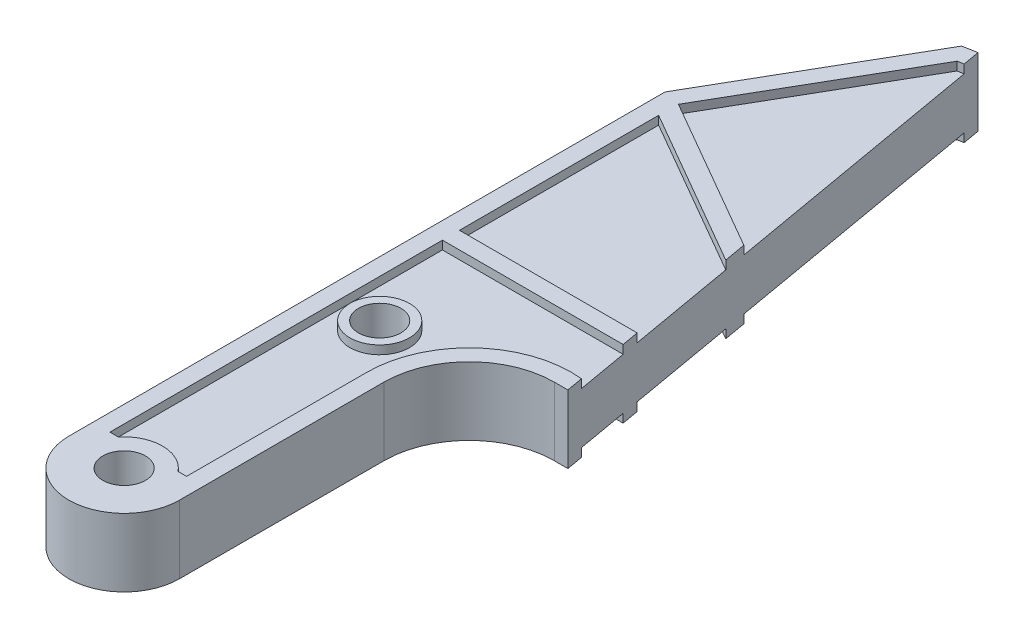
from build123d import *

# Parameters (mm, degrees)
CROQUIS2_R               = 2.5
SALIENTE_EXTRUIR1_DEPTH  = 8
CROQUIS3_R               = 3.5
CORTAR_EXTRUIR1_DEPTH    = 1
CORTAR_EXTRUIR2_START    = -1
CROQUIS4_R               = 3.5
CORTAR_EXTRUIR2_DEPTH    = 1
BOSS_EXTRUDE1_DEPTH      = 10
BOSS_EXTRUDE1_DEPTH_BACK = 18
CUT_EXTRUDE1_DEPTH       = 10
CUT_EXTRUDE2_DEPTH       = 46
CUT_EXTRUDE2_DEPTH_BACK  = 31


with BuildPart() as part:
    # Croquis2 → Saliente-Extruir1 (new body)
    with BuildSketch(Plane(origin=(0, 0, 0), x_dir=(1, 0, 0), z_dir=(0, 1, 0))):
        with BuildLine():
            Line((-6.5, 70), (-6.5, 0))
            ThreePointArc((-6.5, 0), (0, -6.5), (6.5, 0))
            Line((6.5, 0), (6.5, 24))
            ThreePointArc((6.5, 24), (9.428932188, 31.071067812), (16.5, 34))
            Line((16.5, 34), (19.5, 34))
            Line((19.5, 34), (21.621320344, 36.121320344))
            Line((21.621320344, 36.121320344), (19.621320344, 38.121320344))
            Line((19.621320344, 38.121320344), (21.621320344, 40.121320344))
            Line((21.621320344, 40.121320344), (19.621320344, 42.121320344))
            Line((19.621320344, 42.121320344), (21.621320344, 44.121320344))
            ThreePointArc((21.621320344, 44.121320344), (15.831267135, 61.441250358), (13.535653981, 79.558503244))
            Line((13.535653981, 79.558503244), (11.21874212, 81.180822395))
            Line((11.21874212, 81.180822395), (12.841061271, 83.497734256))
            Line((12.841061271, 83.497734256), (10.524149409, 85.120053407))
            Line((10.524149409, 85.120053407), (12.14646856, 87.436965268))
            Line((12.14646856, 87.436965268), (9.829556699, 89.059284419))
            Line((9.829556699, 89.059284419), (11.451875849, 91.37619628))
            Line((11.451875849, 91.37619628), (11.174038765, 92.951888685))
            Line((11.174038765, 92.951888685), (6.25, 92.083647797))
            Line((6.25, 92.083647797), (-6.5, 70))
        make_face()
        with Locations(Location((0, 0, 0), (0, 0, 270))):
            Circle(CROQUIS2_R, mode=Mode.SUBTRACT)
        with Locations(Location((0, 30, 0), (0, 0, 270))):
            Circle(CROQUIS2_R, mode=Mode.SUBTRACT)
    extrude(amount=SALIENTE_EXTRUIR1_DEPTH)

    # Croquis3 → Cortar-Extruir1 (cut)
    # profile 1 of 3: a face of its own
    with BuildSketch(Plane(origin=(0, 8, 0), x_dir=(1, 0, 0), z_dir=(0, 1, 0))):
        with BuildLine():
            Line((7.515743149, 90.275979241), (-4.460249568, 69.532951382))
            Line((-4.460249568, 69.532951382), (14.458313138, 58.610314111))
            ThreePointArc((14.458313138, 58.610314111), (13.59841994, 62.277167356), (12.884475402, 65.975209032))
            Line((12.884475402, 65.975209032), (8.566911861, 90.461328646))
            Line((8.566911861, 90.461328646), (7.515743149, 90.275979241))
        make_face()
    # profile 2 of 3: a face of its own
    with BuildSketch(Plane(origin=(0, 8, 0), x_dir=(1, 0, 0), z_dir=(0, 1, 0))):
        with BuildLine():
            Line((-4.5, 67.246500228), (-4.5, 43.866114746))
            Line((-4.5, 43.866114746), (18.28754604, 43.866114746))
            Line((18.28754604, 43.866114746), (18.28754604, 46.866114746))
            ThreePointArc((18.28754604, 46.866114746), (16.631849149, 51.330235949), (15.201783832, 55.871670029))
            Line((15.201783832, 55.871670029), (-4.5, 67.246500228))
        make_face()
    # profile 3 of 3: a face of its own
    with BuildSketch(Plane(origin=(0, 8, 0), x_dir=(1, 0, 0), z_dir=(0, 1, 0))):
        with BuildLine():
            Line((-4.5, 2.828427125), (-4.5, 41.866114746))
            Line((-4.5, 41.866114746), (18.28754604, 41.866114746))
            Line((18.28754604, 41.866114746), (18.28754604, 35.866114746))
            ThreePointArc((18.28754604, 35.866114746), (8.672182695, 33.095343657), (4.5, 24))
            Line((4.5, 24), (4.5, 2.828427125))
            Line((4.5, 2.828427125), (3.5, 2.828427125))
            ThreePointArc((3.5, 2.828427125), (0, 4.5), (-3.5, 2.828427125))
            Line((-3.5, 2.828427125), (-4.5, 2.828427125))
        make_face()
        with Locations(Location((0, 30, 0), (0, 0, 270))):
            Circle(CROQUIS3_R, mode=Mode.SUBTRACT)
    extrude(amount=-CORTAR_EXTRUIR1_DEPTH, mode=Mode.SUBTRACT)

    # Croquis4 → Cortar-Extruir2 (cut)
    # profile 1 of 3: a face of its own
    with BuildSketch(Plane.XZ.offset(CORTAR_EXTRUIR2_START)):
        with BuildLine():
            Line((4.5, -24), (4.5, -2.828427125))
            Line((4.5, -2.828427125), (3.5, -2.828427125))
            ThreePointArc((3.5, -2.828427125), (0, -4.5), (-3.5, -2.828427125))
            Line((-3.5, -2.828427125), (-4.5, -2.828427125))
            Line((-4.5, -2.828427125), (-4.5, -41.866114746))
            Line((-4.5, -41.866114746), (18.28754604, -41.866114746))
            Line((18.28754604, -41.866114746), (18.28754604, -35.866114746))
            ThreePointArc((18.28754604, -35.866114746), (8.672182695, -33.095343657), (4.5, -24))
        make_face()
        with Locations(Location((0, -30, 0), (0, 0, 90))):
            Circle(CROQUIS4_R, mode=Mode.SUBTRACT)
    # profile 2 of 3: a face of its own
    with BuildSketch(Plane.XZ.offset(CORTAR_EXTRUIR2_START)):
        with BuildLine():
            Line((14.458313138, -58.610314111), (-4.460249568, -69.532951382))
            Line((-4.460249568, -69.532951382), (7.515743149, -90.275979241))
            Line((7.515743149, -90.275979241), (8.566911861, -90.461328646))
            Line((8.566911861, -90.461328646), (12.884475402, -65.975209032))
            ThreePointArc((12.884475402, -65.975209032), (13.59841994, -62.277167356), (14.458313138, -58.610314111))
        make_face()
    # profile 3 of 3: a face of its own
    with BuildSketch(Plane.XZ.offset(CORTAR_EXTRUIR2_START)):
        with BuildLine():
            Line((-4.5, -67.246500228), (15.201783832, -55.871670029))
            ThreePointArc((15.201783832, -55.871670029), (16.631849149, -51.330235949), (18.28754604, -46.866114746))
            Line((18.28754604, -46.866114746), (18.28754604, -43.866114746))
            Line((18.28754604, -43.866114746), (-4.5, -43.866114746))
            Line((-4.5, -43.866114746), (-4.5, -67.246500228))
        make_face()
    extrude(amount=CORTAR_EXTRUIR2_DEPTH, mode=Mode.SUBTRACT)

    # Sketch1 → Boss-Extrude1 (add, two sides: drawn at the far end of the back side and taken through both)
    with BuildSketch(Plane(origin=(0, 0, 0), x_dir=(-1, 0, 0), z_dir=(0, -1, 0)).offset(-BOSS_EXTRUDE1_DEPTH_BACK)):
        Polygon((-10.725693632, 78.218268839), (-13.535653981, 79.558503244), (-11.21874212, 81.180822395), (-12.841061271, 83.497734256), (-10.524149409, 85.120053407), (-12.14646856, 87.436965268), (-9.829556699, 89.059284419), (-11.451875849, 91.37619628), (-11.174038765, 92.951888685), (-8.712019383, 92.517768241), align=None)
    extrude(amount=BOSS_EXTRUDE1_DEPTH + BOSS_EXTRUDE1_DEPTH_BACK)

    # Sketch2 → Cut-Extrude1 (cut)
    with BuildSketch(Plane.XZ):
        Polygon((20.854717439, -45.882271987), (20.061595797, -46.675393628), (20.061595797, -47.817063384), (19.020844567, -48.857814614), (19.213403829, -50.036558505), (18.345213154, -50.90474918), (18.63507803, -51.655887227), (18.345213154, -51.655887227), (18.345213154, -52.50502864), (17.475337304, -52.840714546), (17.942236404, -53.732571601), (17.475337304, -53.732571601), (17.731860677, -54.397310522), (17.060300562, -55.068870638), (17.333638858, -55.705905614), (17.060300562, -55.705905614), (17.060300562, -56.646563198), (16.631849149, -57.159208559), (16.631849149, -58.201545628), (15.831267135, -59.159448073), (16.233608031, -59.750840851), (15.363432322, -60.342845501), (15.831267135, -61.441250358), (15.015003687, -61.996577004), (15.474048684, -63.074344715), (14.594646883, -63.672626132), (15.180653556, -64.533985534), (14.340267552, -65.105723423), (14.855378114, -66.315124537), (13.915417538, -66.954605767), (14.589004763, -67.944698058), (13.915417538, -68.402958115), (14.367306345, -69.46392418), (13.490959077, -70.060127513), (14.163271241, -71.048345618), (13.268305135, -72.119179344), (13.978614858, -72.712831852), (13.268305135, -73.562722816), (13.824014096, -74.379548221), (13.268305135, -74.757612427), (13.740518299, -75.451709043), (12.802233755, -76.090050022), (13.62576872, -77.300547474), (12.802233755, -77.860821134), (13.553992685, -78.96581644), align=None)
    extrude(amount=-CUT_EXTRUDE1_DEPTH, mode=Mode.SUBTRACT)

    # Sketch3 → Cut-Extrude2 (cut, two sides: drawn at the far end of the back side and taken through both)
    with BuildSketch(Plane(origin=(0, 1, 0), x_dir=(-1, 0, 0), z_dir=(0, -1, 0)).offset(-CUT_EXTRUDE2_DEPTH_BACK)):
        Polygon((-19.61873043, 25.285830451), (-7.041341817, 97.124082603), (-21.40830892, 99.639440689), (-35.796516216, 28.118225347), align=None)
    extrude(amount=CUT_EXTRUDE2_DEPTH + CUT_EXTRUDE2_DEPTH_BACK, mode=Mode.SUBTRACT)


solid = part.part
